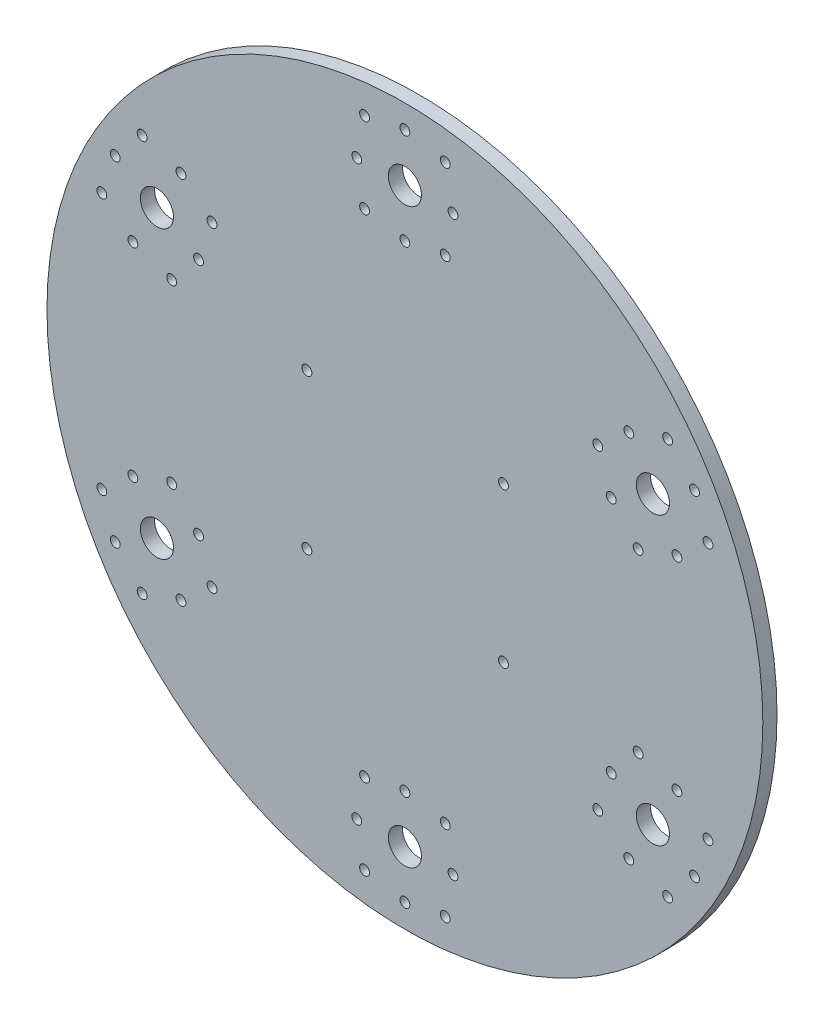
from build123d import *

# Parameters (mm, degrees)
SKETCH1_R           = 80
SKETCH1_R_2         = 1.1
SKETCH1_R_3         = 3.7
SKETCH1_R_4         = 1.11125
BOSS_EXTRUDE2_DEPTH = 3.175


with BuildPart() as part:
    # Sketch1 → Boss-Extrude2 (new body)
    with BuildSketch(Plane.XY):
        Circle(SKETCH1_R)
        with Locations((58.725568667, 44.315554285)):
            Circle(SKETCH1_R_2, mode=Mode.SUBTRACT)
        with Locations((67.741180127, 28.700057175)):
            Circle(SKETCH1_R_2, mode=Mode.SUBTRACT)
        with Locations((64.735398933, 37.375)):
            Circle(SKETCH1_R_2, mode=Mode.SUBTRACT)
        with Locations((50.050625842, 41.309773091)):
            Circle(SKETCH1_R_2, mode=Mode.SUBTRACT)
        with Locations((52.125683017, 19.684445715)):
            Circle(SKETCH1_R_2, mode=Mode.SUBTRACT)
        with Locations((43.110071557, 35.299942825)):
            Circle(SKETCH1_R_2, mode=Mode.SUBTRACT)
        with Locations((60.800625842, 22.690226909)):
            Circle(SKETCH1_R_2, mode=Mode.SUBTRACT)
        with Locations((46.115852752, 26.625)):
            Circle(SKETCH1_R_2, mode=Mode.SUBTRACT)
        with Locations((55.425625842, 32)):
            Circle(SKETCH1_R_3, mode=Mode.SUBTRACT)
        with Locations((-10.75, 64)):
            Circle(SKETCH1_R_2, mode=Mode.SUBTRACT)
        with Locations((-9.01561146, 73.01561146)):
            Circle(SKETCH1_R_2, mode=Mode.SUBTRACT)
        with Locations((9.01561146, 73.01561146)):
            Circle(SKETCH1_R_2, mode=Mode.SUBTRACT)
        with Locations((9.01561146, 54.98438854)):
            Circle(SKETCH1_R_2, mode=Mode.SUBTRACT)
        with Locations((-9.01561146, 54.98438854)):
            Circle(SKETCH1_R_2, mode=Mode.SUBTRACT)
        with Locations((0, 74.75)):
            Circle(SKETCH1_R_2, mode=Mode.SUBTRACT)
        with Locations((10.75, 64)):
            Circle(SKETCH1_R_2, mode=Mode.SUBTRACT)
        with Locations((0, 53.25)):
            Circle(SKETCH1_R_2, mode=Mode.SUBTRACT)
        with Locations((0, 64)):
            Circle(SKETCH1_R_3, mode=Mode.SUBTRACT)
        with Locations((67.741180127, -28.700057175)):
            Circle(SKETCH1_R_2, mode=Mode.SUBTRACT)
        with Locations((58.725568667, -44.315554285)):
            Circle(SKETCH1_R_2, mode=Mode.SUBTRACT)
        with Locations((64.735398933, -37.375)):
            Circle(SKETCH1_R_2, mode=Mode.SUBTRACT)
        with Locations((60.800625842, -22.690226909)):
            Circle(SKETCH1_R_2, mode=Mode.SUBTRACT)
        with Locations((43.110071557, -35.299942825)):
            Circle(SKETCH1_R_2, mode=Mode.SUBTRACT)
        with Locations((52.125683017, -19.684445715)):
            Circle(SKETCH1_R_2, mode=Mode.SUBTRACT)
        with Locations((50.050625842, -41.309773091)):
            Circle(SKETCH1_R_2, mode=Mode.SUBTRACT)
        with Locations((46.115852752, -26.625)):
            Circle(SKETCH1_R_2, mode=Mode.SUBTRACT)
        with Locations((55.425625842, -32)):
            Circle(SKETCH1_R_3, mode=Mode.SUBTRACT)
        with Locations((9.01561146, -73.01561146)):
            Circle(SKETCH1_R_2, mode=Mode.SUBTRACT)
        with Locations((-9.01561146, -73.01561146)):
            Circle(SKETCH1_R_2, mode=Mode.SUBTRACT)
        with Locations((0, -74.75)):
            Circle(SKETCH1_R_2, mode=Mode.SUBTRACT)
        with Locations((10.75, -64)):
            Circle(SKETCH1_R_2, mode=Mode.SUBTRACT)
        with Locations((-9.01561146, -54.98438854)):
            Circle(SKETCH1_R_2, mode=Mode.SUBTRACT)
        with Locations((9.01561146, -54.98438854)):
            Circle(SKETCH1_R_2, mode=Mode.SUBTRACT)
        with Locations((-10.75, -64)):
            Circle(SKETCH1_R_2, mode=Mode.SUBTRACT)
        with Locations((0, -53.25)):
            Circle(SKETCH1_R_2, mode=Mode.SUBTRACT)
        with Locations((0, -64)):
            Circle(SKETCH1_R_3, mode=Mode.SUBTRACT)
        with Locations((-58.725568667, -44.315554285)):
            Circle(SKETCH1_R_2, mode=Mode.SUBTRACT)
        with Locations((-67.741180127, -28.700057175)):
            Circle(SKETCH1_R_2, mode=Mode.SUBTRACT)
        with Locations((-64.735398933, -37.375)):
            Circle(SKETCH1_R_2, mode=Mode.SUBTRACT)
        with Locations((-50.050625842, -41.309773091)):
            Circle(SKETCH1_R_2, mode=Mode.SUBTRACT)
        with Locations((-52.125683017, -19.684445715)):
            Circle(SKETCH1_R_2, mode=Mode.SUBTRACT)
        with Locations((-43.110071557, -35.299942825)):
            Circle(SKETCH1_R_2, mode=Mode.SUBTRACT)
        with Locations((-60.800625842, -22.690226909)):
            Circle(SKETCH1_R_2, mode=Mode.SUBTRACT)
        with Locations((-46.115852752, -26.625)):
            Circle(SKETCH1_R_2, mode=Mode.SUBTRACT)
        with Locations((-55.425625842, -32)):
            Circle(SKETCH1_R_3, mode=Mode.SUBTRACT)
        with Locations((-67.741180127, 28.700057175)):
            Circle(SKETCH1_R_2, mode=Mode.SUBTRACT)
        with Locations((-58.725568667, 44.315554285)):
            Circle(SKETCH1_R_2, mode=Mode.SUBTRACT)
        with Locations((-64.735398933, 37.375)):
            Circle(SKETCH1_R_2, mode=Mode.SUBTRACT)
        with Locations((-60.800625842, 22.690226909)):
            Circle(SKETCH1_R_2, mode=Mode.SUBTRACT)
        with Locations((-43.110071557, 35.299942825)):
            Circle(SKETCH1_R_2, mode=Mode.SUBTRACT)
        with Locations((-52.125683017, 19.684445715)):
            Circle(SKETCH1_R_2, mode=Mode.SUBTRACT)
        with Locations((-50.050625842, 41.309773091)):
            Circle(SKETCH1_R_2, mode=Mode.SUBTRACT)
        with Locations((-46.115852752, 26.625)):
            Circle(SKETCH1_R_2, mode=Mode.SUBTRACT)
        with Locations((-55.425625842, 32)):
            Circle(SKETCH1_R_3, mode=Mode.SUBTRACT)
        with Locations((22.0345, 17.272)):
            Circle(SKETCH1_R_4, mode=Mode.SUBTRACT)
        with Locations((22.0345, -17.272)):
            Circle(SKETCH1_R_4, mode=Mode.SUBTRACT)
        with Locations((-21.9075, -17.272)):
            Circle(SKETCH1_R_4, mode=Mode.SUBTRACT)
        with Locations((-21.9075, 17.272)):
            Circle(SKETCH1_R_4, mode=Mode.SUBTRACT)
    extrude(amount=BOSS_EXTRUDE2_DEPTH)


solid = part.part
